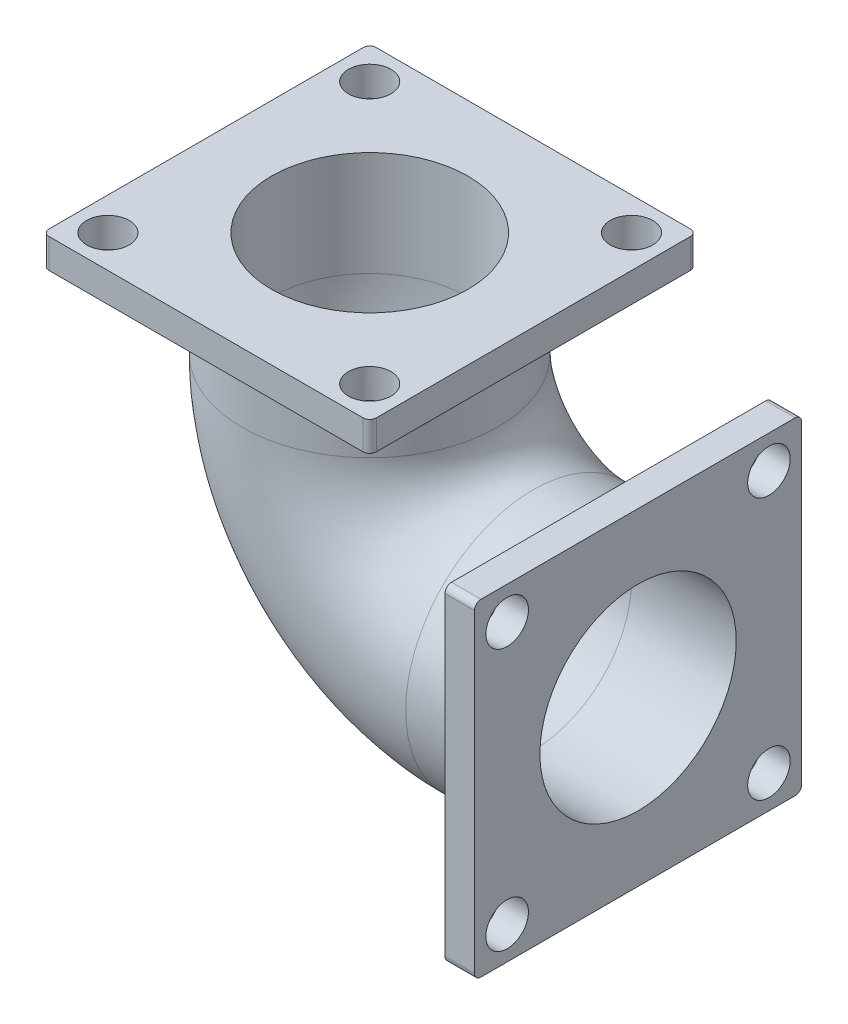
from build123d import *

# Parameters (mm, degrees)
SKETCH3_R           = 195
SKETCH3_R_2         = 150
BOSS_EXTRUDE3_START = -45
SKETCH8_W           = 500
SKETCH8_H           = 500
SKETCH8_R           = 195
BOSS_EXTRUDE3_DEPTH = 45
FILLET3_R           = 10
SKETCH9_W           = 500
SKETCH9_H           = 500
SKETCH9_R           = 195
BOSS_EXTRUDE4_DEPTH = 45
FILLET4_R           = 10
CUT_EXTRUDE2_REACH  = 818.211
SKETCH10_R          = 32.5
CIRPATTERN2_COUNT   = 4
CUT_EXTRUDE3_REACH  = 968.282
SKETCH11_R          = 32.5
CIRPATTERN3_COUNT   = 4


with BuildPart() as part:
    # Sweep-Thin4: sweep along a path in Sketch2
    with BuildLine(Plane.XY) as sweep_thin4_path:
        Line((0, 0), (-160, 0))
        ThreePointArc((-160, 0), (-336.776695297, 73.223304703), (-410, 250))
        Line((-410, 250), (-410, 410))
    # Sketch3 → Sweep-Thin4 (sweep)
    with BuildSketch(Plane(origin=(0, 0, 0), x_dir=(0, 0, -1), z_dir=(1, 0, 0))):
        Circle(SKETCH3_R)
        Circle(SKETCH3_R_2, mode=Mode.SUBTRACT)
    sweep(path=sweep_thin4_path.line)

    # Sketch8 → Boss-Extrude3 (add)
    with BuildSketch(Plane(origin=(0, 0, 0), x_dir=(0, 0, -1), z_dir=(1, 0, 0)).offset(BOSS_EXTRUDE3_START)):
        Rectangle(SKETCH8_W, SKETCH8_H)
        with Locations(Location((0, 0, 0), (0, 0, 270))):
            Circle(SKETCH8_R, mode=Mode.SUBTRACT)
    extrude(amount=BOSS_EXTRUDE3_DEPTH)

    # Fillet3
    fillet3_edges = [part.edges().sort_by_distance(p)[0] for p in [
        (-22.5, 250, -250),
        (-22.5, -250, -250),
        (-22.5, -250, 250),
        (-22.5, 250, 250),
    ]]
    fillet(fillet3_edges, radius=FILLET3_R)

    # Sketch9 → Boss-Extrude4 (add)
    with BuildSketch(Plane(origin=(0, 410, 0), x_dir=(1, 0, 0), z_dir=(0, 1, 0))):
        with Locations((-410, 0)):
            Rectangle(SKETCH9_W, SKETCH9_H)
        with Locations(Location((-410, 0, 0), (0, 0, 270))):
            Circle(SKETCH9_R, mode=Mode.SUBTRACT)
    extrude(amount=-BOSS_EXTRUDE4_DEPTH)

    # Fillet4
    fillet4_edges = [part.edges().sort_by_distance(p)[0] for p in [
        (-660, 387.5, -250),
        (-160, 387.5, -250),
        (-160, 387.5, 250),
        (-660, 387.5, 250),
    ]]
    fillet(fillet4_edges, radius=FILLET4_R)

    # Sketch10 → Cut-Extrude2 (cut, up to next)
    with BuildSketch(Plane(origin=(0, 0, 0), x_dir=(0, 0, -1), z_dir=(1, 0, 0)), mode=Mode.PRIVATE) as cut_extrude2_sk1:
        with Locations((-200, 200)):
            Circle(SKETCH10_R)
    cut_extrude2_tool1 = extrude(cut_extrude2_sk1.sketch, amount=-CUT_EXTRUDE2_REACH, mode=Mode.PRIVATE) & part.part
    cut_extrude2 = cut_extrude2_tool1.solids().sort_by_distance((0, 200, 200))[0]
    add(cut_extrude2, mode=Mode.SUBTRACT)

    # CirPattern2: Cut-Extrude2 ×4 about axis
    cirpattern2_axis = Axis((0, 0, 0), (1, 0, 0))
    for i in range(1, CIRPATTERN2_COUNT):
        add(cut_extrude2.rotate(cirpattern2_axis, i * 360 / CIRPATTERN2_COUNT), mode=Mode.SUBTRACT)

    # Sketch11 → Cut-Extrude3 (cut, up to next)
    with BuildSketch(Plane(origin=(0, 410, 0), x_dir=(1, 0, 0), z_dir=(0, 1, 0)), mode=Mode.PRIVATE) as cut_extrude3_sk1:
        with Locations(Location((-610, 200, 0), (0, 0, 270))):
            Circle(SKETCH11_R)
    cut_extrude3_tool1 = extrude(cut_extrude3_sk1.sketch, amount=-CUT_EXTRUDE3_REACH, mode=Mode.PRIVATE) & part.part
    cut_extrude3 = cut_extrude3_tool1.solids().sort_by_distance((-610, 410, -200))[0]
    add(cut_extrude3, mode=Mode.SUBTRACT)

    # CirPattern3: Cut-Extrude3 ×4 about axis
    cirpattern3_axis = Axis((-410, 0, 0), (0, 1, 0))
    for i in range(1, CIRPATTERN3_COUNT):
        add(cut_extrude3.rotate(cirpattern3_axis, i * 360 / CIRPATTERN3_COUNT), mode=Mode.SUBTRACT)


solid = part.part
